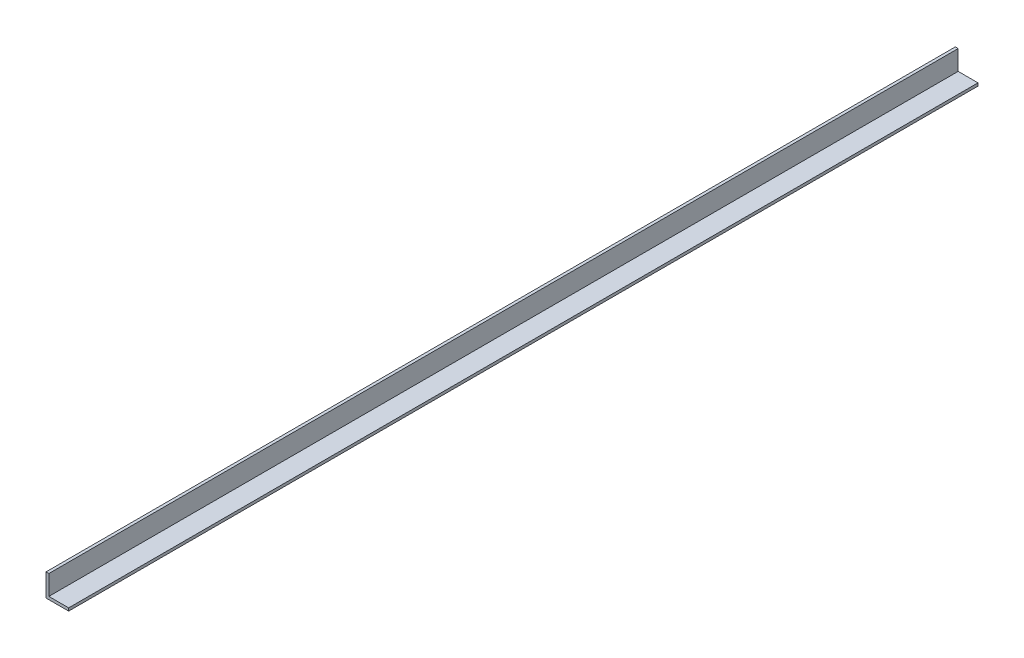
from build123d import *

# Parameters (mm, degrees)
SALIENTE_EXTRUIR1_DEPTH = 6100


with BuildPart() as part:
    # Croquis1 → Saliente-Extruir1 (new body)
    with BuildSketch(Plane.XY):
        Polygon((0, 152), (0, 0), (152, 0), (152, 19.05), (19.05, 19.05), (19.05, 152), align=None)
    extrude(amount=-SALIENTE_EXTRUIR1_DEPTH)


solid = part.part
